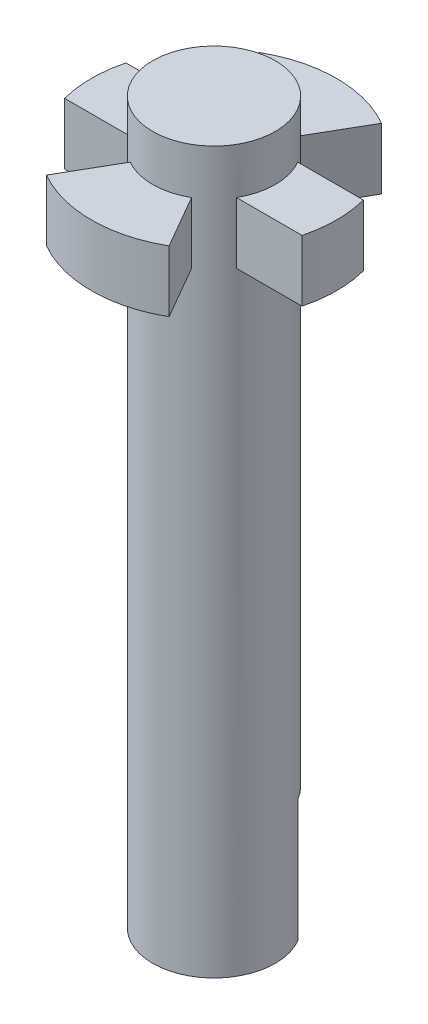
from build123d import *

# Parameters (mm, degrees)
SKETCH1_R           = 4
BOSS_EXTRUDE1_DEPTH = 47
BOSS_EXTRUDE2_DEPTH = 2
CUT_EXTRUDE1_DEPTH  = 8


with BuildPart() as part:
    # Sketch1 → Boss-Extrude1 (new body)
    with BuildSketch(Plane(origin=(0, 0, 0), x_dir=(1, 0, 0), z_dir=(0, 1, 0))):
        with Locations(Location((0, 0, 0), (0, 0, 270))):
            Circle(SKETCH1_R)
    extrude(amount=BOSS_EXTRUDE1_DEPTH)

    # Sketch2 → Boss-Extrude2 (add, symmetric)
    with BuildSketch(Plane(origin=(0, 42, 0), x_dir=(1, 0, 0), z_dir=(0, 1, 0))):
        with BuildLine():
            Line((-4, 6.92820323), (-2, 3.464101615))
            ThreePointArc((-2, 3.464101615), (0, 4), (2, 3.464101615))
            Line((2, 3.464101615), (4, 6.92820323))
            ThreePointArc((4, 6.92820323), (0, 8), (-4, 6.92820323))
        make_face()
        with BuildLine():
            Line((-7.745966692, 2), (-3.464101615, 2))
            ThreePointArc((-3.464101615, 2), (-4, 0), (-3.464101615, -2))
            Line((-3.464101615, -2), (-7.745966692, -2))
            ThreePointArc((-7.745966692, -2), (-8, 0), (-7.745966692, 2))
        make_face()
        with BuildLine():
            Line((7.745966692, 2), (3.464101615, 2))
            ThreePointArc((3.464101615, 2), (4, 0), (3.464101615, -2))
            Line((3.464101615, -2), (7.745966692, -2))
            ThreePointArc((7.745966692, -2), (8, 0), (7.745966692, 2))
        make_face()
        with BuildLine():
            Line((4, -6.92820323), (2, -3.464101615))
            ThreePointArc((2, -3.464101615), (0, -4), (-2, -3.464101615))
            Line((-2, -3.464101615), (-4, -6.92820323))
            ThreePointArc((-4, -6.92820323), (0, -8), (4, -6.92820323))
        make_face()
    extrude(amount=BOSS_EXTRUDE2_DEPTH, both=True)

    # Sketch3 → Cut-Extrude1 (cut)
    with BuildSketch(Plane.XZ):
        with BuildLine():
            Line((-3.464101615, -2), (3.464101615, -2))
            ThreePointArc((3.464101615, -2), (0, -4), (-3.464101615, -2))
        make_face()
    extrude(amount=-CUT_EXTRUDE1_DEPTH, mode=Mode.SUBTRACT)


solid = part.part
